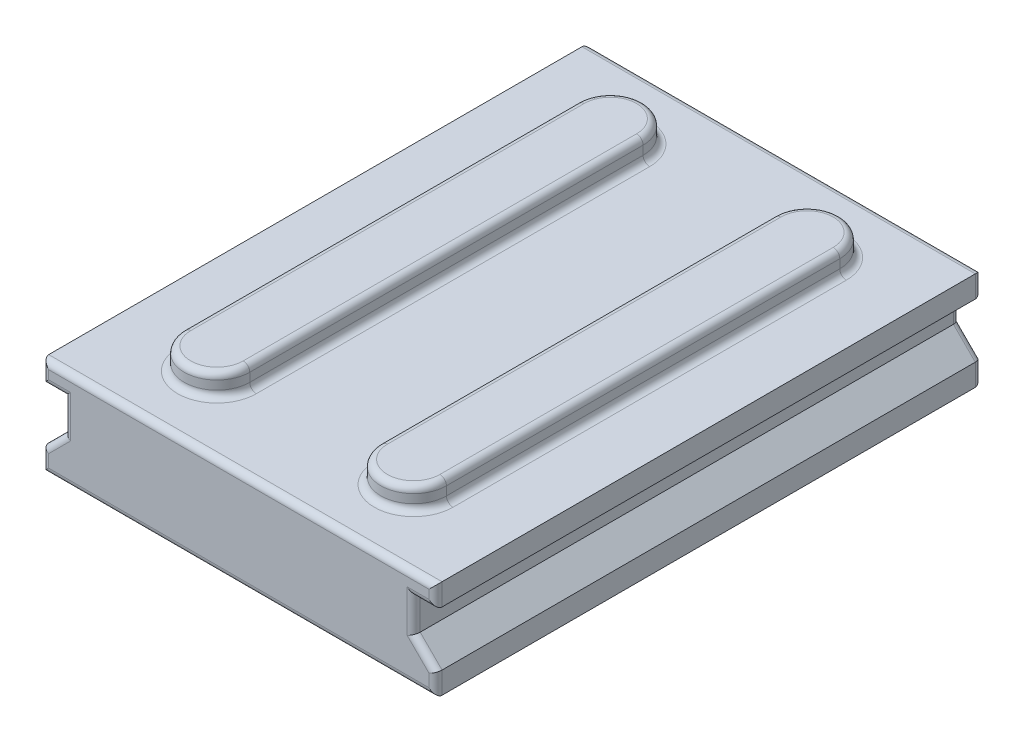
from build123d import *

# Parameters (mm, degrees)
BOSS_EXTRUDE1_DEPTH = 25
BOSS_EXTRUDE2_DEPTH = 1
FILLET1_R           = 0.3
FILLET2_R           = 0.3


with BuildPart() as part:
    # Sketch1 → Boss-Extrude1 (new body)
    with BuildSketch(Plane.XY):
        Polygon((8, -1), (8, -2.5), (9, -3.5), (9, -4.5), (-9, -4.5), (-9, -3.5), (-8, -2.5), (-8, -1), (-9, -1), (-9, 0), (9, 0), (9, -1), align=None)
    extrude(amount=BOSS_EXTRUDE1_DEPTH)

    # Sketch2 → Boss-Extrude2 (add)
    with BuildSketch(Plane(origin=(0, 0, 0), x_dir=(1, 0, 0), z_dir=(0, 1, 0))):
        with BuildLine():
            Line((6, -3.5), (6, -21.5))
            ThreePointArc((6, -21.5), (4.5, -23), (3, -21.5))
            Line((3, -21.5), (3, -3.5))
            ThreePointArc((3, -3.5), (4.5, -2), (6, -3.5))
        make_face()
        with BuildLine():
            Line((-6, -3.5), (-6, -21.5))
            ThreePointArc((-6, -21.5), (-4.5, -23), (-3, -21.5))
            Line((-3, -21.5), (-3, -3.5))
            ThreePointArc((-3, -3.5), (-4.5, -2), (-6, -3.5))
        make_face()
    extrude(amount=BOSS_EXTRUDE2_DEPTH)

    # Fillet1
    fillet1_edges = [part.edges().sort_by_distance(p)[0] for p in [
        (4.5, 0, 2),
        (3, 0, 12.5),
        (4.5, 0, 23),
        (6, 0, 12.5),
        (4.5, 1, 2),
        (3, 1, 12.5),
        (4.5, 1, 23),
        (6, 1, 12.5),
        (-4.5, 0, 2),
        (-6, 0, 12.5),
        (-4.5, 0, 23),
        (-3, 0, 12.5),
        (-4.5, 1, 2),
        (-6, 1, 12.5),
        (-4.5, 1, 23),
        (-3, 1, 12.5),
    ]]
    fillet(fillet1_edges, radius=FILLET1_R)

    # Fillet2
    fillet2_edges = [part.edges().sort_by_distance(p)[0] for p in [
        (8, -1.75, 0),
        (8.5, -3, 0),
        (0, 0, 25),
        (9, -4, 0),
        (0, -4.5, 0),
        (-9, -4, 0),
        (-8.5, -3, 0),
        (-8, -1.75, 0),
        (-8.5, -1, 0),
        (-9, -0.5, 0),
        (0, 0, 0),
        (9, -0.5, 0),
        (8.5, -1, 0),
        (-9, -0.5, 25),
        (-8.5, -1, 25),
        (-8, -1.75, 25),
        (-8.5, -3, 25),
        (-9, -4, 25),
        (0, -4.5, 25),
        (9, -4, 25),
        (8.5, -3, 25),
        (8, -1.75, 25),
        (8.5, -1, 25),
        (9, -0.5, 25),
    ]]
    fillet(fillet2_edges, radius=FILLET2_R)


solid = part.part
